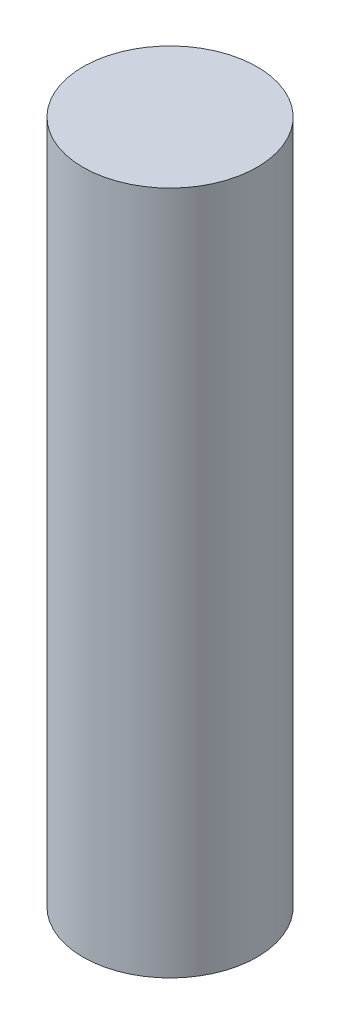
from build123d import *

# Parameters (mm, degrees)
SKETCH1_R           = 3.5
BOSS_EXTRUDE1_DEPTH = 27.5


with BuildPart() as part:
    # Sketch1 → Boss-Extrude1 (new body)
    with BuildSketch(Plane(origin=(0, 0, 0), x_dir=(1, 0, 0), z_dir=(0, 1, 0))):
        with Locations(Location((0, 0, 0), (0, 0, 270))):
            Circle(SKETCH1_R)
    extrude(amount=BOSS_EXTRUDE1_DEPTH)


solid = part.part
